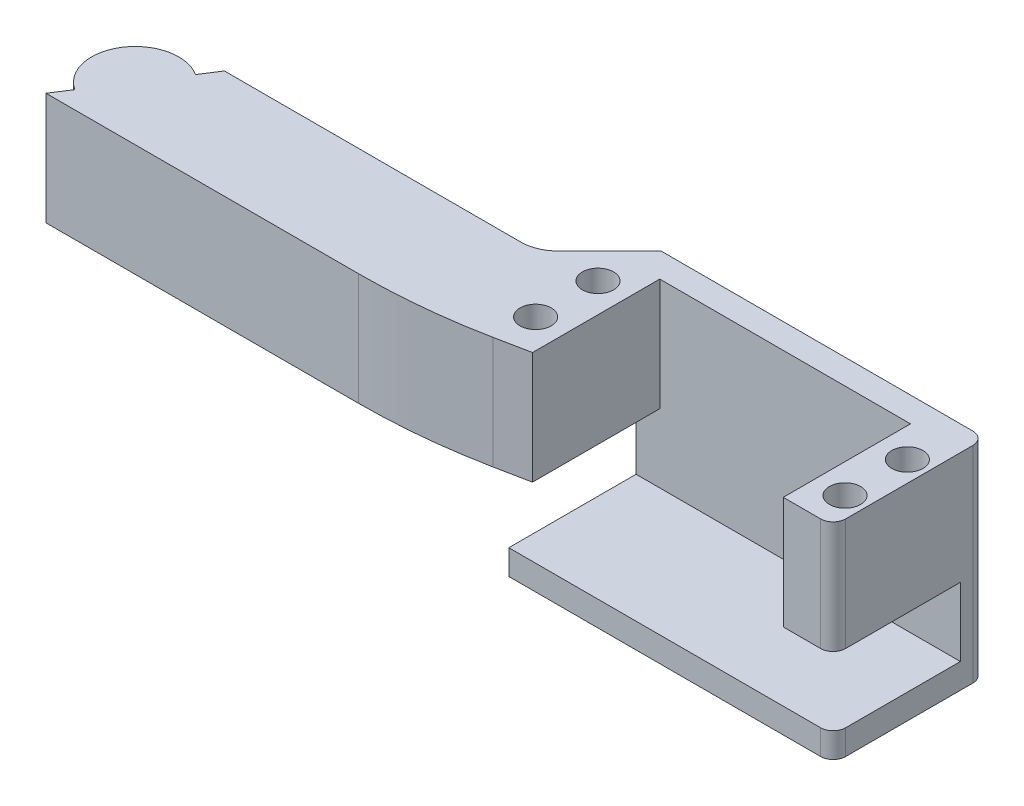
from build123d import *

# Parameters (mm, degrees)
BOSS_EXTRUDE1_DEPTH = 18
SKETCH2_W           = 52
SKETCH2_H           = 29
BOSS_EXTRUDE2_DEPTH = 4
SKETCH3_W           = 52
SKETCH3_H           = 24.4
BOSS_EXTRUDE3_DEPTH = 4
SKETCH4_R           = 2.5
BOSS_EXTRUDE4_DEPTH = 5
SKETCH5_R           = 2.5
CUT_EXTRUDE1_DEPTH  = 18
FILLET2_R           = 6
FILLET4_R           = 2
FILLET5_R           = 100


with BuildPart() as part:
    # Sketch1 → Boss-Extrude1 (new body)
    with BuildSketch(Plane(origin=(0, 0, 0), x_dir=(1, 0, 0), z_dir=(0, 1, 0))):
        with BuildLine():
            Line((-40.2, 0), (-40.2, 20.4))
            Line((-40.2, 20.4), (0, 20.4))
            Line((0, 20.4), (0, 0))
            Line((0, 0), (8, 0))
            Line((8, 0), (8, 24.4))
            Line((8, 24.4), (-44, 24.4))
            Line((-44, 24.4), (-54, 14.4))
            Line((-54, 14.4), (-104, 14.4))
            Line((-104, 14.4), (-105.811278075, 11.586050134))
            ThreePointArc((-105.811278075, 11.586050134), (-115.486050134, 9.488721925), (-113.388721925, -0.186050134))
            Line((-113.388721925, -0.186050134), (-115.2, -3))
            Line((-115.2, -3), (-55.2, -3))
            Line((-55.2, -3), (-40.2, 0))
        make_face()
    extrude(amount=BOSS_EXTRUDE1_DEPTH)

    # Sketch2 → Boss-Extrude2 (add)
    with BuildSketch(Plane(origin=(0, 0, -24.4), x_dir=(-1, 0, 0), z_dir=(0, 0, -1))):
        with Locations((18, 3.5)):
            Rectangle(SKETCH2_W, SKETCH2_H)
    extrude(amount=-BOSS_EXTRUDE2_DEPTH)

    # Sketch3 → Boss-Extrude3 (add)
    with BuildSketch(Plane.XZ.offset(11)):
        with Locations((-18, -12.2)):
            Rectangle(SKETCH3_W, SKETCH3_H)
    extrude(amount=BOSS_EXTRUDE3_DEPTH)

    # Sketch4 → Boss-Extrude4 (add)
    with BuildSketch(Plane.XZ.offset(15)):
        with Locations(Location((-10.1, -10.2, 0), (0, 0, 270))):
            Circle(SKETCH4_R)
    extrude(amount=BOSS_EXTRUDE4_DEPTH)

    # Sketch5 → Cut-Extrude1 (cut)
    with BuildSketch(Plane(origin=(0, 18, 0), x_dir=(1, 0, 0), z_dir=(0, 1, 0))):
        with Locations(Location((4.7, 15.2, 0), (0, 0, 270))):
            Circle(SKETCH5_R)
        with Locations(Location((4.7, 5.2, 0), (0, 0, 270))):
            Circle(SKETCH5_R)
        with Locations(Location((-44.9, 5.2, 0), (0, 0, 270))):
            Circle(SKETCH5_R)
        with Locations(Location((-44.9, 15.2, 0), (0, 0, 270))):
            Circle(SKETCH5_R)
    extrude(amount=-CUT_EXTRUDE1_DEPTH, mode=Mode.SUBTRACT)

    # Fillet2
    fillet2_edges = [part.edges().sort_by_distance(p)[0] for p in [
        (-54, 9, -14.4),
    ]]
    fillet(fillet2_edges, radius=FILLET2_R)

    # Fillet4
    fillet4_edges = [part.edges().sort_by_distance(p)[0] for p in [
        (8, 1.5, -24.4),
        (8, 9, 0),
        (8, -13, 0),
    ]]
    fillet(fillet4_edges, radius=FILLET4_R)

    # Fillet5
    fillet5_edges = [part.edges().sort_by_distance(p)[0] for p in [
        (-55.2, 9, 3),
    ]]
    fillet(fillet5_edges, radius=FILLET5_R)


solid = part.part
